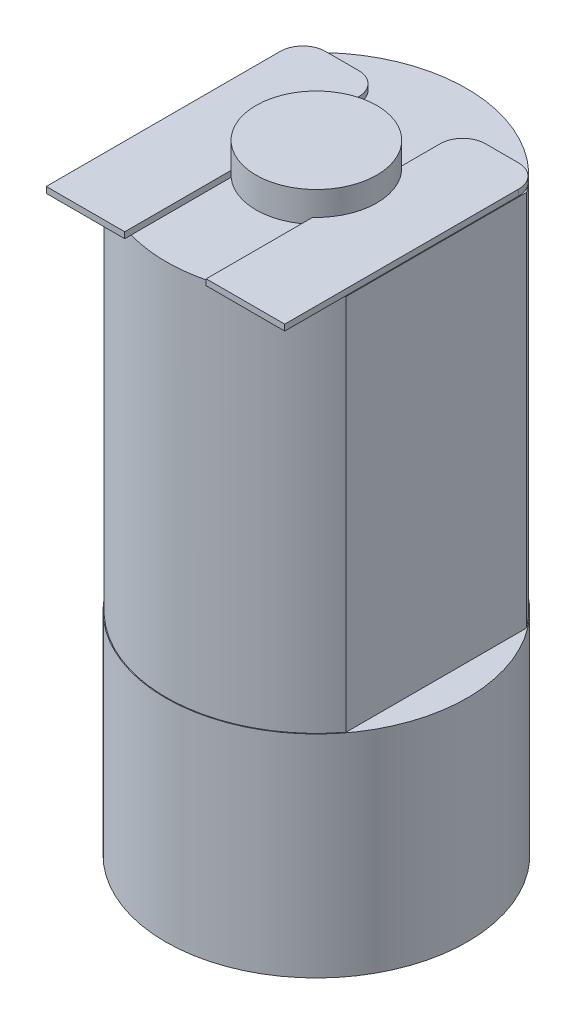
from build123d import *

# Parameters (mm, degrees)
SKETCH2_R           = 5
BOSS_EXTRUDE1_DEPTH = 7
BOSS_EXTRUDE2_DEPTH = 12.5
BOSS_EXTRUDE3_DEPTH = 0.2
SKETCH5_R           = 2
BOSS_EXTRUDE4_DEPTH = 1


with BuildPart() as part:
    # Sketch2 → Boss-Extrude1 (new body)
    with BuildSketch(Plane(origin=(0, 0, 0), x_dir=(1, 0, 0), z_dir=(0, 1, 0))):
        with Locations(Location((0, 0, 0), (0, 0, 270))):
            Circle(SKETCH2_R)
    extrude(amount=BOSS_EXTRUDE1_DEPTH)

    # Sketch3 → Boss-Extrude2 (add)
    with BuildSketch(Plane(origin=(0, 7, 0), x_dir=(1, 0, 0), z_dir=(0, 1, 0))):
        with BuildLine():
            Line((-3.975, 2.99165506), (-3.975, -2.99165506))
            ThreePointArc((-3.975, -2.99165506), (0, -4.975), (3.975, -2.99165506))
            Line((3.975, -2.99165506), (3.975, 2.99165506))
            ThreePointArc((3.975, 2.99165506), (0, 4.975), (-3.975, 2.99165506))
        make_face()
    extrude(amount=BOSS_EXTRUDE2_DEPTH)

    # Sketch4 → Boss-Extrude3 (add)
    with BuildSketch(Plane(origin=(0, 19.5, 0), x_dir=(1, 0, 0), z_dir=(0, 1, 0))):
        with BuildLine():
            Line((-3.2, 3.5), (-2.1, 3.5))
            ThreePointArc((-2.1, 3.5), (-1.569669914, 3.280330086), (-1.35, 2.75))
            Line((-1.35, 2.75), (-1.35, -5))
            Line((-1.35, -5), (-3.95, -5))
            Line((-3.95, -5), (-3.95, 2.75))
            ThreePointArc((-3.95, 2.75), (-3.730330086, 3.280330086), (-3.2, 3.5))
        make_face()
        with BuildLine():
            Line((3.95, -5), (1.35, -5))
            Line((1.35, -5), (1.35, 2.75))
            ThreePointArc((1.35, 2.75), (1.569669914, 3.280330086), (2.1, 3.5))
            Line((2.1, 3.5), (3.2, 3.5))
            ThreePointArc((3.2, 3.5), (3.730330086, 3.280330086), (3.95, 2.75))
            Line((3.95, 2.75), (3.95, -5))
        make_face()
    extrude(amount=BOSS_EXTRUDE3_DEPTH)

    # Sketch5 → Boss-Extrude4 (add)
    with BuildSketch(Plane(origin=(0, 19.5, 0), x_dir=(1, 0, 0), z_dir=(0, 1, 0))):
        with Locations(Location((0, 0, 0), (0, 0, 47.545849796))):
            Circle(SKETCH5_R)
    extrude(amount=BOSS_EXTRUDE4_DEPTH)


solid = part.part
